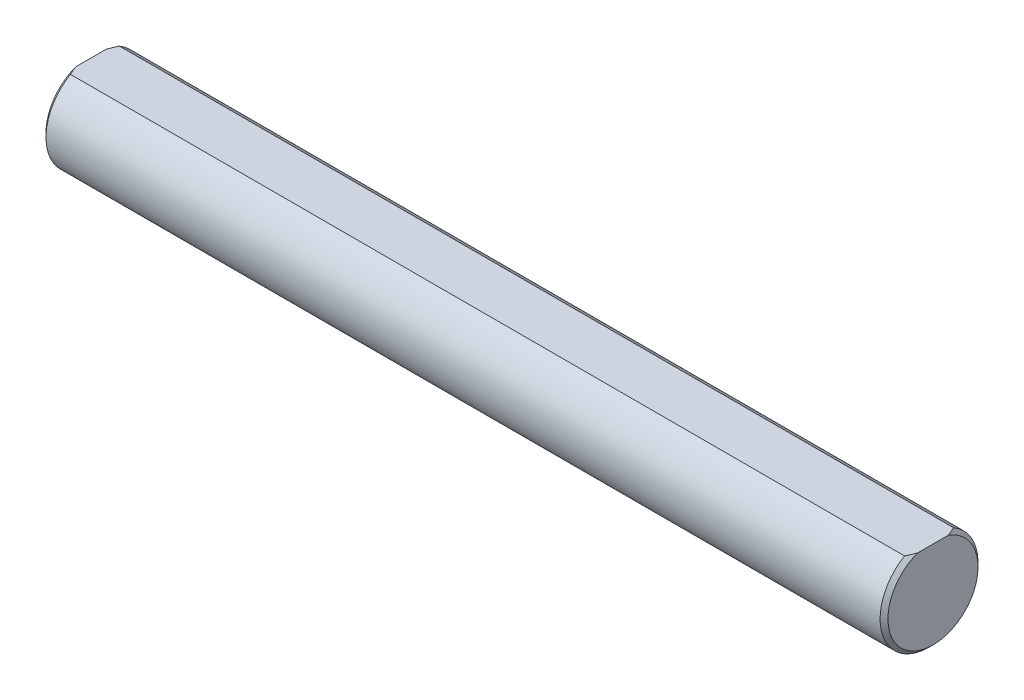
from build123d import *

# Parameters (mm, degrees)
SKETCH1_R           = 3.175
BOSS_EXTRUDE1_DEPTH = 54.61
CHAMFER1_SIZE       = 0.254
CUT_EXTRUDE2_DEPTH  = 55.794282092


with BuildPart() as part:
    # Sketch1 → Boss-Extrude1 (new body)
    with BuildSketch(Plane(origin=(0, 0, 0), x_dir=(0, 0, -1), z_dir=(1, 0, 0))):
        Circle(SKETCH1_R)
    extrude(amount=BOSS_EXTRUDE1_DEPTH)

    # Chamfer1
    chamfer1_edges = [part.edges().sort_by_distance(p)[0] for p in [
        (0, 0, 3.175),
        (54.61, 0, 3.175),
    ]]
    chamfer(chamfer1_edges, length=CHAMFER1_SIZE)

    # Sketch2 → Cut-Extrude2 (cut, through all)
    with BuildSketch(Plane(origin=(54.61, 0, 0), x_dir=(0, 0, -1), z_dir=(1, 0, 0))):
        with BuildLine():
            Line((-1.5875, 2.749630657), (1.5875, 2.749630657))
            ThreePointArc((1.5875, 2.749630657), (0, 3.175), (-1.5875, 2.749630657))
        make_face()
    extrude(amount=-CUT_EXTRUDE2_DEPTH, mode=Mode.SUBTRACT)


solid = part.part
